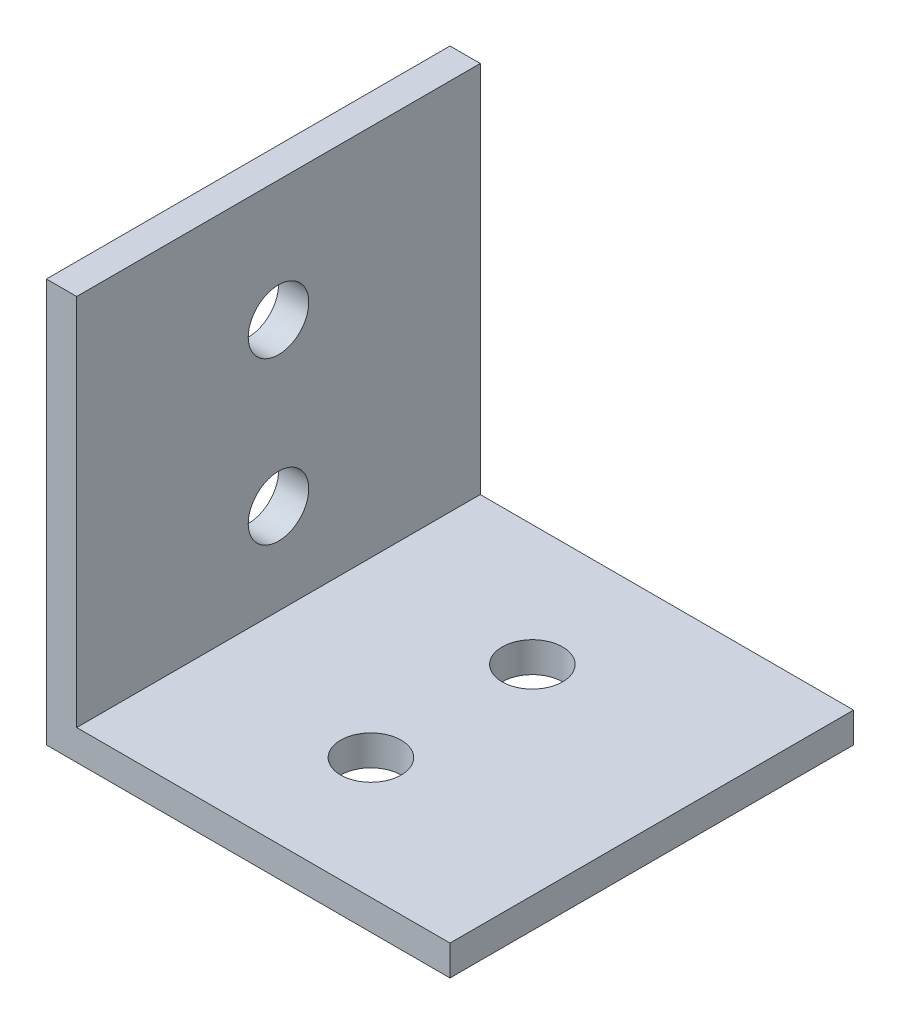
from build123d import *

# Parameters (mm, degrees)
EXTRUSION1_DEPTH = 20
ESQUISSE2_R      = 1.5
EXTRUSION2_DEPTH = 20
ESQUISSE3_R      = 1.5
EXTRUSION3_DEPTH = 10


with BuildPart() as part:
    # Esquisse1 → Extrusion1 (new body)
    with BuildSketch(Plane.XY):
        Polygon((-18.714271359, 3.498089172), (-18.714271359, -16.501910828), (1.285728641, -16.501910828), (1.285728641, -15.001910828), (-17.214271359, -15.001910828), (-17.214271359, 3.498089172), align=None)
    extrude(amount=EXTRUSION1_DEPTH)

    # Esquisse2 → Extrusion2 (cut)
    with BuildSketch(Plane(origin=(0, -15.001910828, 0), x_dir=(-1, 0, 0), z_dir=(0, 1, 0))):
        with Locations((8.633652734, 14)):
            Circle(ESQUISSE2_R)
        with Locations((8.633652734, 6)):
            Circle(ESQUISSE2_R)
    extrude(amount=-EXTRUSION2_DEPTH, mode=Mode.SUBTRACT)

    # Esquisse3 → Extrusion3 (cut)
    with BuildSketch(Plane.ZY.offset(18.714271359)):
        with Locations(Location((10, -10.501910828, 0), (0, 0, 270))):
            Circle(ESQUISSE3_R)
        with Locations(Location((10, -2.501910828, 0), (0, 0, 270))):
            Circle(ESQUISSE3_R)
    extrude(amount=-EXTRUSION3_DEPTH, mode=Mode.SUBTRACT)


solid = part.part
